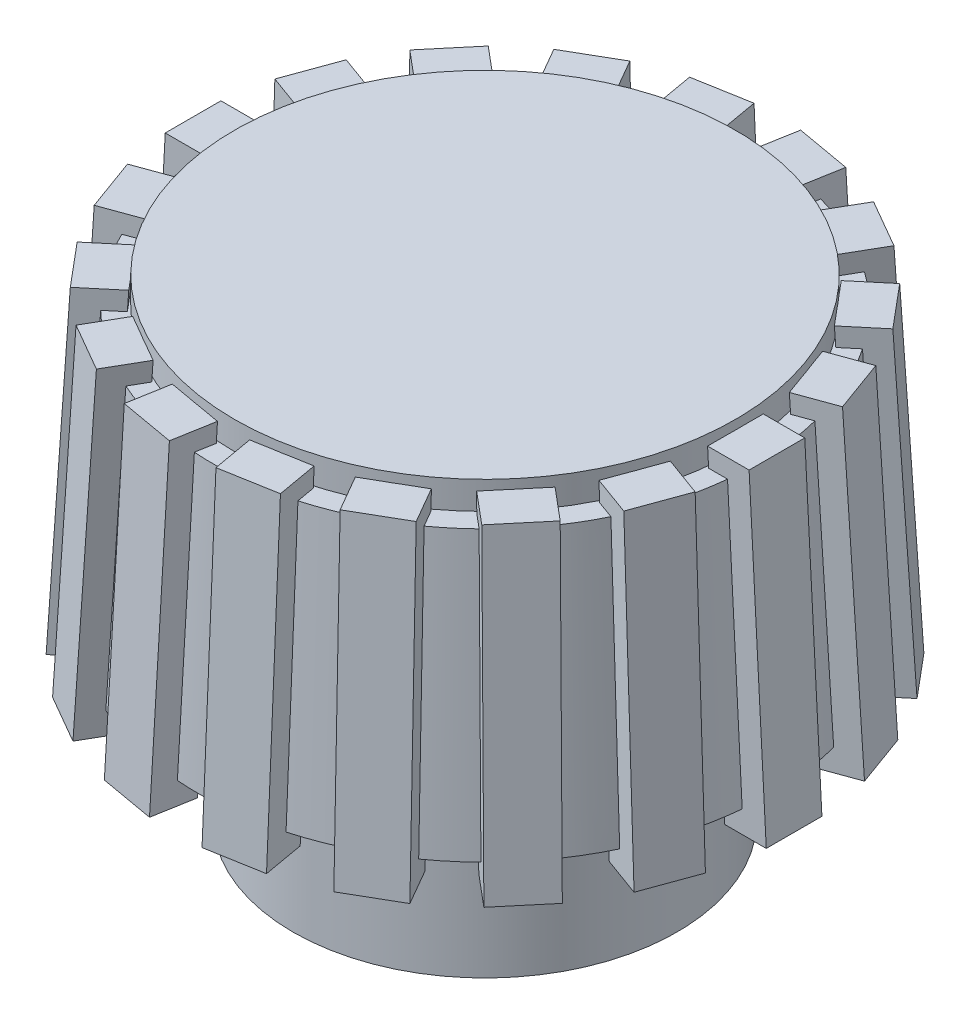
from build123d import *

# Parameters (mm, degrees)
SKETCH1_R           = 3.45
BOSS_EXTRUDE1_DEPTH = 3
SKETCH2_R           = 5.144351969
BOSS_EXTRUDE2_DEPTH = 5
BOSS_EXTRUDE2_TAPER = 3
BOSS_EXTRUDE3_DEPTH = 0.5
CIRPATTERN1_COUNT   = 18
SKETCH5_R           = 4.5
BOSS_EXTRUDE5_DEPTH = 0.5


with BuildPart() as part:
    # Sketch1 → Boss-Extrude1 (new body)
    with BuildSketch(Plane(origin=(0, 0, 0), x_dir=(1, 0, 0), z_dir=(0, 1, 0))):
        with Locations(Location((0, 0, 0), (0, 0, 270))):
            Circle(SKETCH1_R)
    extrude(amount=BOSS_EXTRUDE1_DEPTH)

    # Sketch2 → Boss-Extrude2 (add)
    with BuildSketch(Plane(origin=(0, 3, 0), x_dir=(1, 0, 0), z_dir=(0, 1, 0))):
        Circle(SKETCH2_R)
    extrude(amount=BOSS_EXTRUDE2_DEPTH, taper=BOSS_EXTRUDE2_TAPER)

    # Sketch4 → Boss-Extrude3 (add, symmetric)
    with BuildSketch(Plane.XY):
        Polygon((-4.498373747, 8.334987069), (-4.806833662, 2.602773665), (-5.552278454, 2.602773665), (-5.24381854, 8.334987069), align=None)
    boss_extrude3 = extrude(amount=BOSS_EXTRUDE3_DEPTH, both=True)

    # CirPattern1: Boss-Extrude3 ×18 about axis
    cirpattern1_axis = Axis((0, 0, 0), (0, 1, 0))
    for i in range(1, CIRPATTERN1_COUNT):
        add(boss_extrude3.rotate(cirpattern1_axis, i * 360 / CIRPATTERN1_COUNT))

    # Sketch5 → Boss-Extrude5 (add)
    with BuildSketch(Plane(origin=(0, 8, 0), x_dir=(1, 0, 0), z_dir=(0, 1, 0))):
        with Locations(Location((0, 0, 0), (0, 0, 270))):
            Circle(SKETCH5_R)
    extrude(amount=BOSS_EXTRUDE5_DEPTH)


solid = part.part
